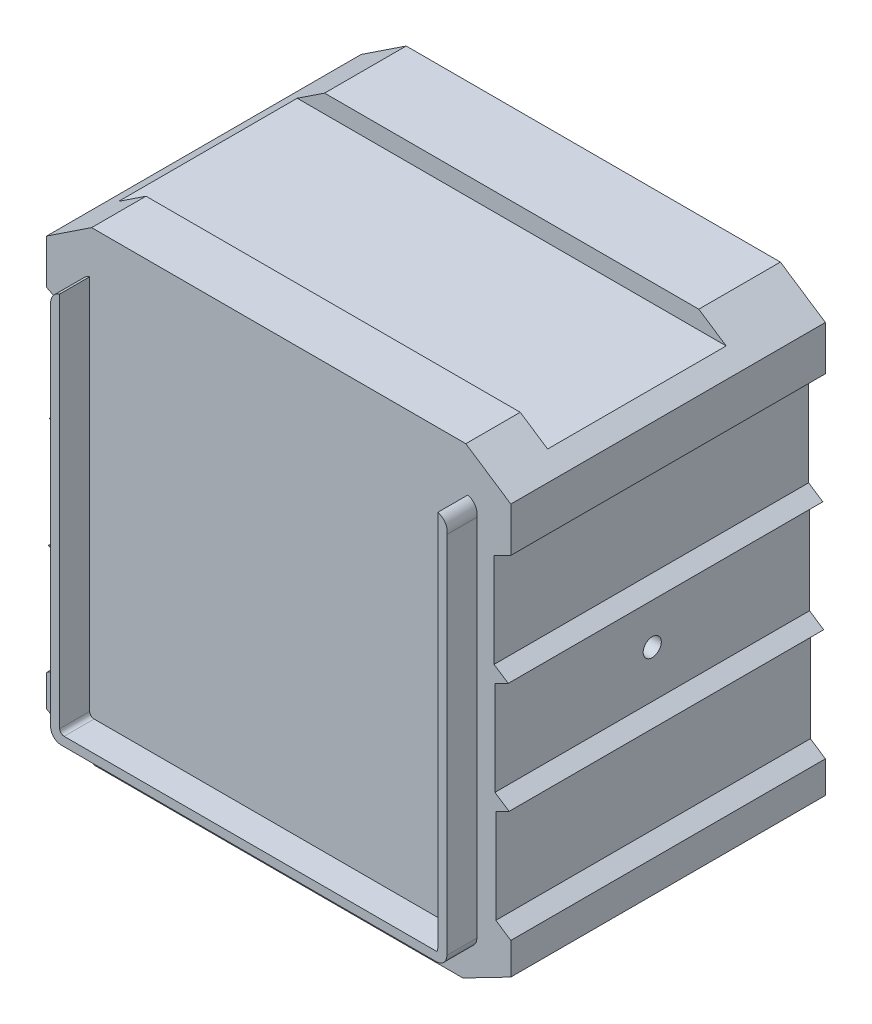
from build123d import *

# Parameters (mm, degrees)
BOSS_EXTRUDE1_DEPTH = 173.478
BOSS_EXTRUDE2_DEPTH = 16.522
SKETCH5_W           = 256
SKETCH5_H           = 98.478
CUT_EXTRUDE3_DEPTH  = 10
SKETCH7_R           = 5
CUT_EXTRUDE4_DEPTH  = 404.448315513


with BuildPart() as part:
    # Sketch1 → Boss-Extrude1 (new body)
    with BuildSketch(Plane.XY):
        Polygon((-103.1895488, 0), (103.1895488, 0), (128, -16.432610434), (128, -40.962966098), (118.774155672, -45.61934731), (118.774155672, -97.61934731), (126.583328469, -102.791566604), (119.25400561, -106.490753372), (119.25400561, -158.490753372), (127.063178407, -163.662972666), (119.733855548, -167.362159434), (119.733855548, -219.362159434), (128, -224.837043001), (128, -242.345271931), (101.558790198, -256), (-101.558790198, -256), (-128, -242.345271931), (-128, -224.837043001), (-119.733855548, -219.362159434), (-119.733855548, -167.362159434), (-127.063178407, -163.662972666), (-119.25400561, -158.490753372), (-119.25400561, -106.490753372), (-126.583328469, -102.791566604), (-118.774155672, -97.61934731), (-118.774155672, -45.61934731), (-128, -40.962966098), (-128, -16.432610434), align=None)
    extrude(amount=BOSS_EXTRUDE1_DEPTH)

    # Sketch3 → Boss-Extrude2 (add)
    with BuildSketch(Plane.XY.offset(173.478)):
        with BuildLine():
            Line((-109.25400561, -30.77642723), (-109.25400561, -233.134965715))
            ThreePointArc((-109.25400561, -233.134965715), (-107.53617684, -237.28217123), (-103.388971325, -239))
            Line((-103.388971325, -239), (103.388971325, -239))
            ThreePointArc((103.388971325, -239), (107.53617684, -237.28217123), (109.25400561, -233.134965715))
            Line((109.25400561, -233.134965715), (109.25400561, -32.174007784))
            ThreePointArc((109.25400561, -32.174007784), (108.447882002, -27.049094521), (104.25400561, -23.99524907))
            Line((104.25400561, -23.99524907), (104.25400561, -231.784495248))
            ThreePointArc((104.25400561, -231.784495248), (104.136715259, -232.916299233), (103.789829206, -234))
            Line((103.789829206, -234), (-101.829987525, -234))
            ThreePointArc((-101.829987525, -234), (-103.544027151, -233.290021541), (-104.25400561, -231.575981915))
            Line((-104.25400561, -231.575981915), (-104.25400561, -23.99524907))
            ThreePointArc((-104.25400561, -23.99524907), (-107.868861491, -26.563815889), (-109.25400561, -30.77642723))
        make_face()
    extrude(amount=BOSS_EXTRUDE2_DEPTH)

    # Sketch5 → Cut-Extrude3 (cut)
    with BuildSketch(Plane(origin=(0, 0, 0), x_dir=(1, 0, 0), z_dir=(0, 1, 0))):
        with Locations((0, -94.239)):
            Rectangle(SKETCH5_W, SKETCH5_H)
    extrude(amount=-CUT_EXTRUDE3_DEPTH, mode=Mode.SUBTRACT)

    # Sketch7 → Cut-Extrude4 (cut, through all)
    with BuildSketch(Plane(origin=(119.25400561, 0, 0), x_dir=(0, 0, -1), z_dir=(1, 0, 0))):
        with Locations(Location((-86.739, -132.490753372, 0), (0, 0, 90))):
            Circle(SKETCH7_R)
    extrude(amount=-CUT_EXTRUDE4_DEPTH, mode=Mode.SUBTRACT)


solid = part.part
